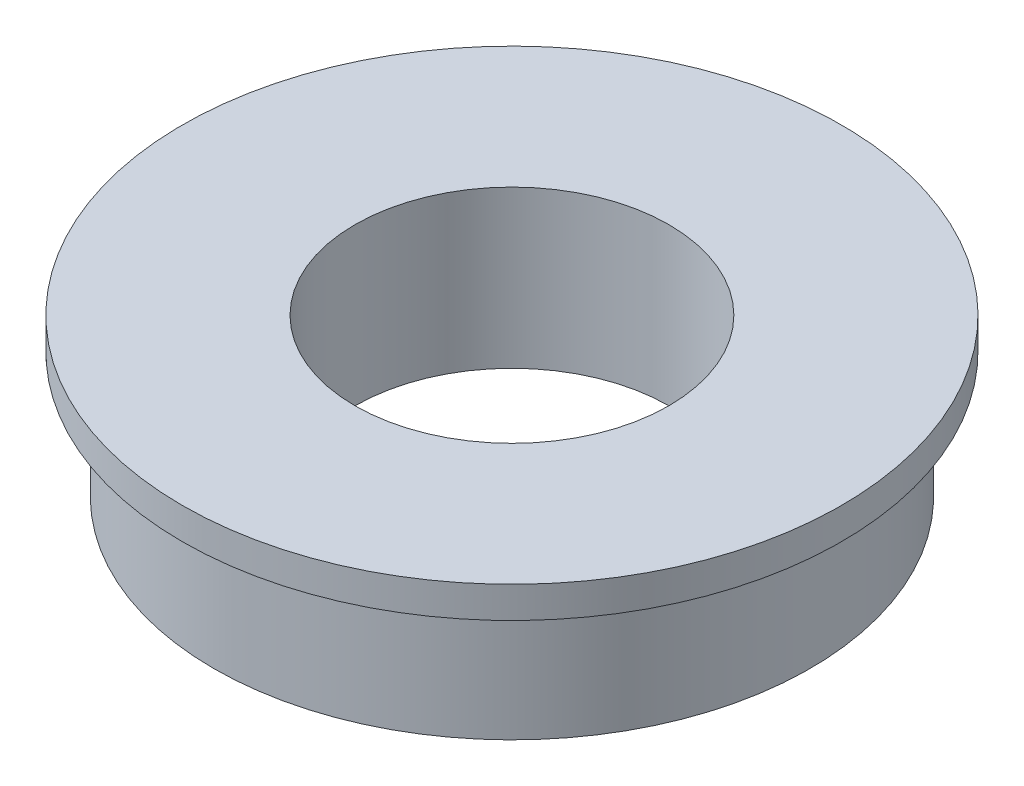
from build123d import *

# Parameters (mm, degrees)
SKETCH_1_R      = 9.5
SKETCH_1_R_2    = 5
EXTRUDE_1_DEPTH = 5
EXTRUDE_START   = -1
SKETCH_2_R      = 10.5
SKETCH_2_R_2    = 9.5
EXTRUDE_2_DEPTH = 1


with BuildPart() as part:
    # 草图1 → 凸台-拉伸1 (new body)
    with BuildSketch(Plane(origin=(0, 0, 0), x_dir=(1, 0, 0), z_dir=(0, 1, 0))):
        with Locations(Location((0, 0, 0), (0, 0, 270))):
            Circle(SKETCH_1_R)
        with Locations(Location((0, 0, 0), (0, 0, 270))):
            Circle(SKETCH_1_R_2, mode=Mode.SUBTRACT)
    extrude(amount=EXTRUDE_1_DEPTH)

    # 草图2 → 凸台-拉伸2 (add)
    with BuildSketch(Plane(origin=(0, 5, 0), x_dir=(1, 0, 0), z_dir=(0, 1, 0)).offset(EXTRUDE_START)):
        with Locations(Location((0, 0, 0), (0, 0, 270))):
            Circle(SKETCH_2_R)
        with Locations(Location((0, 0, 0), (0, 0, 270))):
            Circle(SKETCH_2_R_2, mode=Mode.SUBTRACT)
    extrude(amount=EXTRUDE_2_DEPTH)


solid = part.part
